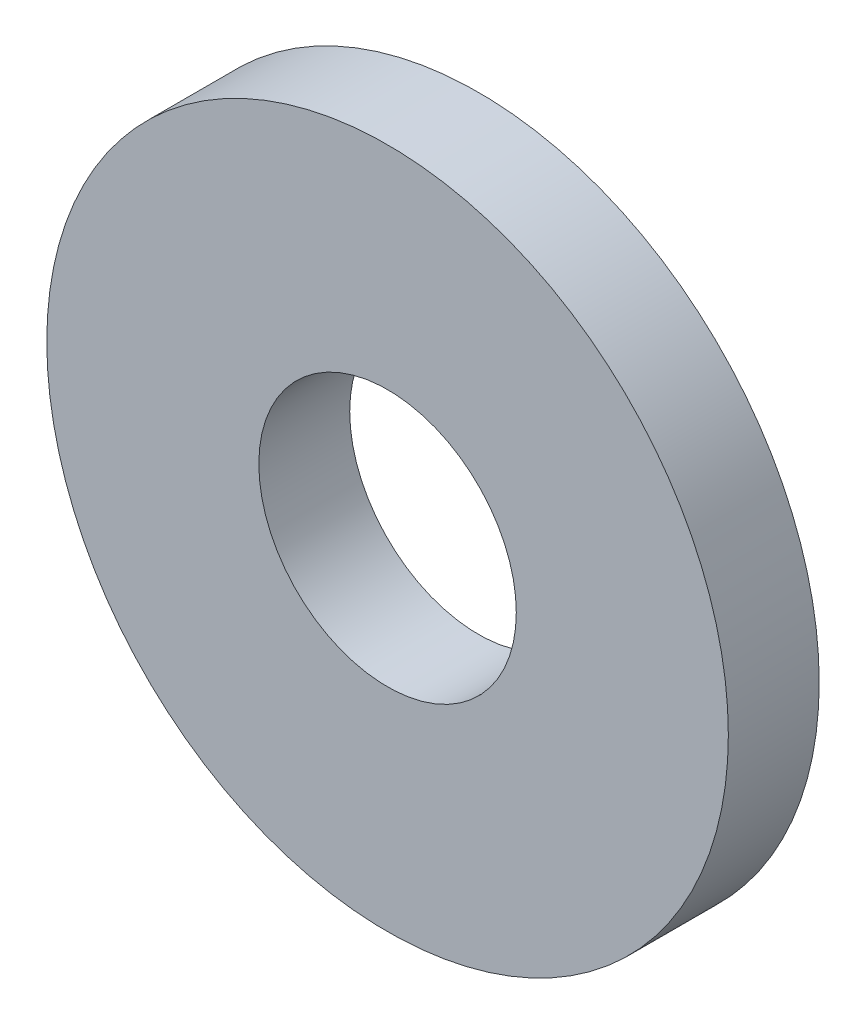
from build123d import *

# Parameters (mm, degrees)
RETAINER_START         = -36.7
RETAINER_SKETCH_R      = 4.5
RETAINER_SKETCH_R_2    = 1.7
RETAINER_EXTRUDE_DEPTH = 1.2


with BuildPart() as part:
    # Retainer Sketch → Retainer Extrude (new body)
    with BuildSketch(Plane.XY.offset(RETAINER_START)):
        Circle(RETAINER_SKETCH_R)
        Circle(RETAINER_SKETCH_R_2, mode=Mode.SUBTRACT)
    extrude(amount=RETAINER_EXTRUDE_DEPTH)


solid = part.part
